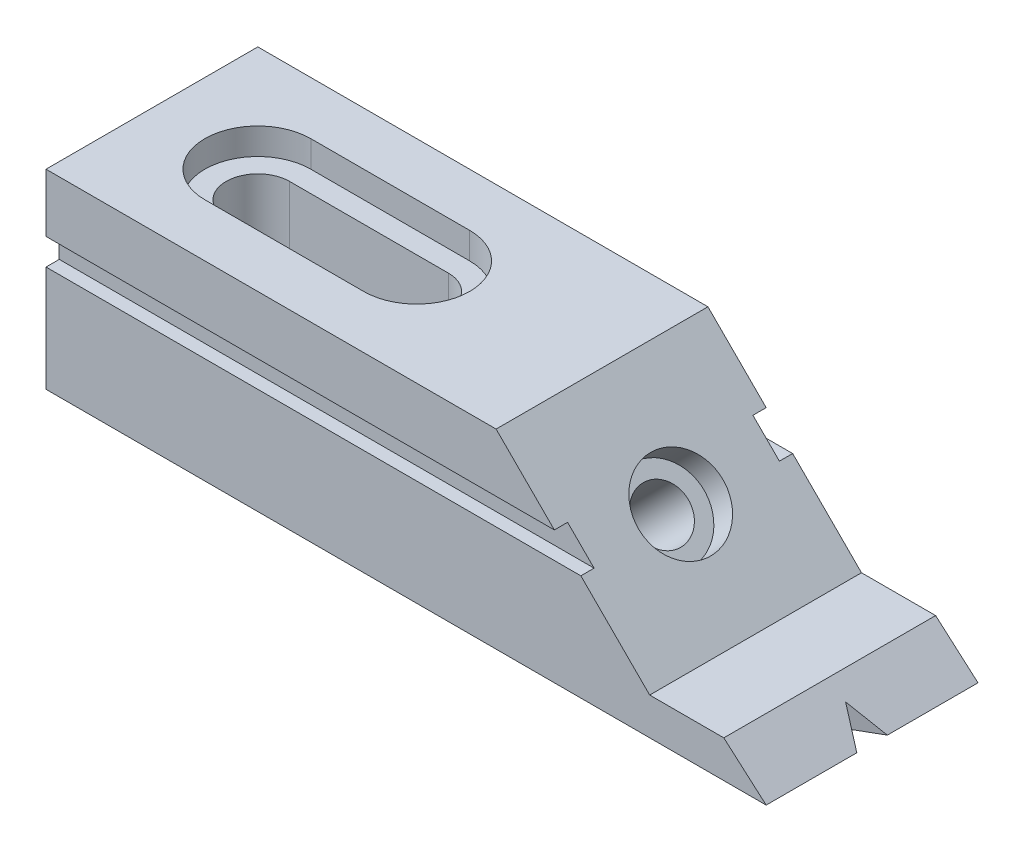
from build123d import *

# Parameters (mm, degrees)
BOSS_EXTRUDE1_DEPTH = 25.4
SKETCH2_R           = 6.35
CUT_EXTRUDE1_DEPTH  = 126.469958357
SKETCH3_R           = 10.16
CUT_EXTRUDE2_DEPTH  = 6.35
CUT_EXTRUDE3_DEPTH  = 179.420310783
SKETCH6_W           = 3.175
SKETCH6_H           = 6.35
CUT_EXTRUDE4_DEPTH  = 181.46516783
CUT_EXTRUDE5_DEPTH  = 6.35
CUT_EXTRUDE6_DEPTH  = 179.961882254


with BuildPart() as part:
    # Sketch1 → Boss-Extrude1 (new, symmetric)
    with BuildSketch(Plane.XY):
        Polygon((0, 0), (172.72, 0), (162.56, 8.89), (144.78, 8.89), (107.95, 45.72), (0, 45.72), align=None)
    extrude(amount=BOSS_EXTRUDE1_DEPTH, both=True)

    # Sketch2 → Cut-Extrude1 (cut, through all)
    with BuildSketch(Plane(origin=(76.835, 76.835, 0), x_dir=(0, 0, -1), z_dir=(0.7071067811865482, 0.7071067811865468, 0))):
        with Locations(Location((0, -70.688740495, 0), (0, 0, 90))):
            Circle(SKETCH2_R)
    extrude(amount=-CUT_EXTRUDE1_DEPTH, mode=Mode.SUBTRACT)

    # Sketch3 → Cut-Extrude2 (cut)
    with BuildSketch(Plane(origin=(76.835, 76.835, 0), x_dir=(0, 0, -1), z_dir=(0.7071067811865482, 0.7071067811865468, 0))):
        with Locations(Location((0, -70.688740495, 0), (0, 0, 90))):
            Circle(SKETCH3_R)
    extrude(amount=-CUT_EXTRUDE2_DEPTH, mode=Mode.SUBTRACT)

    # Sketch5 → Cut-Extrude3 (cut, through all)
    with BuildSketch(Plane(origin=(0, 8.89, 0), x_dir=(1, 0, 0), z_dir=(0, 1, 0))):
        Polygon((166.37, 0), (177.602369567, 6.485011593), (177.602369567, -6.485011593), align=None)
    extrude(amount=-CUT_EXTRUDE3_DEPTH, mode=Mode.SUBTRACT)

    # Sketch6 → Cut-Extrude4 (cut, through all)
    with BuildSketch(Plane(origin=(0, 0, 0), x_dir=(0, 0, -1), z_dir=(1, 0, 0))):
        with Locations((-23.8125, 28.575)):
            Rectangle(SKETCH6_W, SKETCH6_H)
        with Locations((23.8125, 28.575)):
            Rectangle(SKETCH6_W, SKETCH6_H)
    extrude(amount=CUT_EXTRUDE4_DEPTH, mode=Mode.SUBTRACT)

    # Sketch7 → Cut-Extrude5 (cut)
    with BuildSketch(Plane(origin=(0, 45.72, 0), x_dir=(1, 0, 0), z_dir=(0, 1, 0))):
        with BuildLine():
            Line((25.4, 12.7), (63.5, 12.7))
            ThreePointArc((63.5, 12.7), (76.2, 0), (63.5, -12.7))
            Line((63.5, -12.7), (25.4, -12.7))
            ThreePointArc((25.4, -12.7), (12.7, 0), (25.4, 12.7))
        make_face()
    extrude(amount=-CUT_EXTRUDE5_DEPTH, mode=Mode.SUBTRACT)

    # Sketch8 → Cut-Extrude6 (cut, through all)
    with BuildSketch(Plane(origin=(0, 39.37, 0), x_dir=(1, 0, 0), z_dir=(0, 1, 0))):
        with BuildLine():
            Line((25.4, -7.62), (63.5, -7.62))
            ThreePointArc((63.5, -7.62), (71.12, 0), (63.5, 7.62))
            Line((63.5, 7.62), (25.4, 7.62))
            ThreePointArc((25.4, 7.62), (17.78, 0), (25.4, -7.62))
        make_face()
    extrude(amount=-CUT_EXTRUDE6_DEPTH, mode=Mode.SUBTRACT)


solid = part.part
